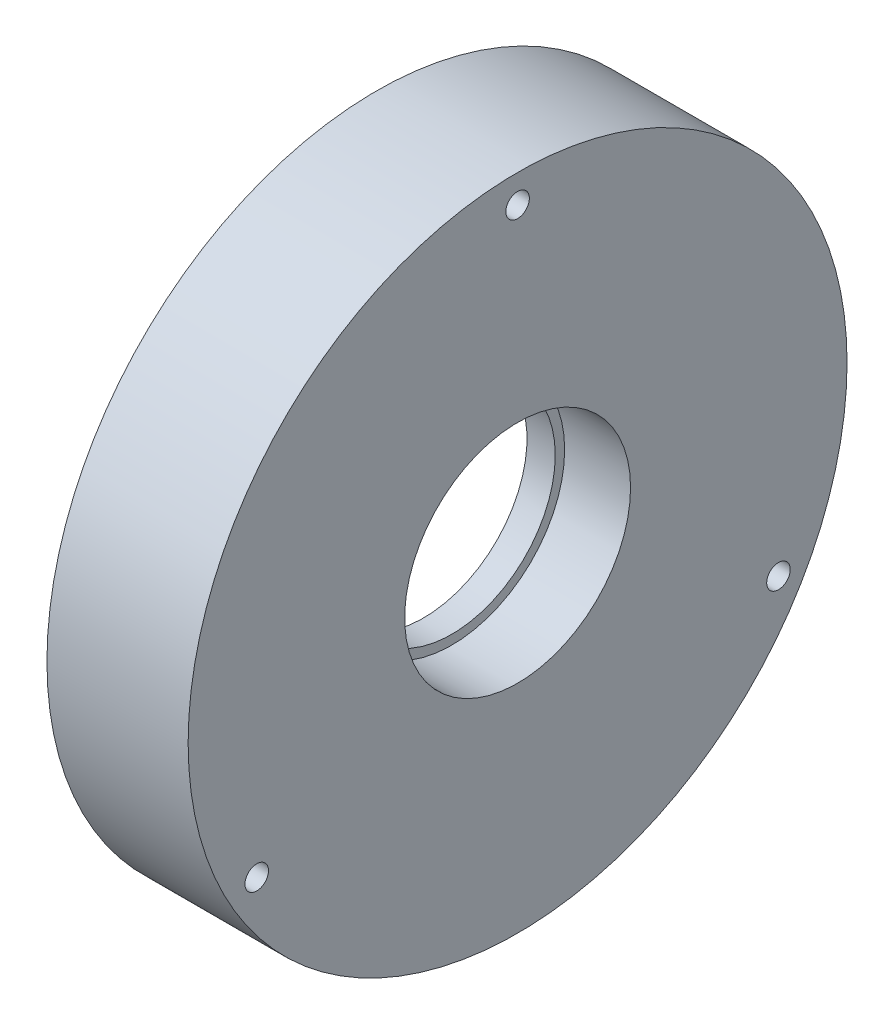
from build123d import *

# Parameters (mm, degrees)
BASPROSKE_W         = 5
BASPROSKE_H         = 4.25
TOOTHCUT_DEPTH      = 26.248762346
TEETHCUTS_COUNT     = 55
TEETHCUTS_ANGLE     = 353.454545455
BOSS_EXTRUDE1_START = 2.5
SKETCH1_R           = 17.5
SKETCH1_R_2         = 5.5
BOSS_EXTRUDE1_DEPTH = 2.5
SKETCH2_R           = 7.75
SKETCH2_R_2         = 5.5
BOSS_EXTRUDE2_DEPTH = 2.5
SKETCH3_R           = 6
CUT_EXTRUDE1_DEPTH  = 3.5
M1_6_TAPPED_HOLE1_D = 1.25
CIRPATTERN1_COUNT   = 3


with BuildPart() as part:
    # BasProSke → Base-Revolve (revolve)
    with BuildSketch(Plane(origin=(0, 0, 0), x_dir=(1, 0, 0), z_dir=(0, 1, 0)), mode=Mode.PRIVATE) as base_revolve_sk:
        with Locations((2.5, 15.375)):
            Rectangle(BASPROSKE_W, BASPROSKE_H)
    revolve(base_revolve_sk.sketch.rotate(Axis((-10, 0, 0), (1, 0, 0)), 180), axis=Axis((-10, 0, 0), (1, 0, 0)))

    # TooCutSke → ToothCut (cut, through all)
    with BuildSketch(Plane(origin=(0, 0, 0), x_dir=(0, 0, -1), z_dir=(1, 0, 0))):
        with BuildLine():
            ThreePointArc((0.61765291, 13.210168434), (0.417066145, 13.802967889), (0.163405078, 14.375071297))
            ThreePointArc((0.163405078, 14.375071297), (0, 14.376), (-0.163405078, 14.375071297))
            ThreePointArc((-0.163405078, 14.375071297), (-0.417066145, 13.802967889), (-0.61765291, 13.210168434))
            ThreePointArc((-0.61765291, 13.210168434), (0, 13.2246), (0.61765291, 13.210168434))
        make_face()
    toothcut = extrude(amount=TOOTHCUT_DEPTH, mode=Mode.SUBTRACT)

    # TeethCuts: ToothCut ×55 about axis
    teethcuts_axis = Axis((-10, 0, 0), (1, 0, 0))
    for i in range(1, TEETHCUTS_COUNT):
        add(toothcut.rotate(teethcuts_axis, i * TEETHCUTS_ANGLE / (TEETHCUTS_COUNT - 1)), mode=Mode.SUBTRACT)

    # Sketch1 → Boss-Extrude1 (add)
    with BuildSketch(Plane(origin=(5, 0, 0), x_dir=(0, 0, -1), z_dir=(1, 0, 0)).offset(BOSS_EXTRUDE1_START)):
        with Locations(Location((0, 0, 0), (0, 0, 180))):
            Circle(SKETCH1_R)
        Circle(SKETCH1_R_2, mode=Mode.SUBTRACT)
    extrude(amount=-BOSS_EXTRUDE1_DEPTH)

    # Sketch2 → Boss-Extrude2 (add)
    with BuildSketch(Plane.ZY.offset(-5)):
        with Locations(Location((0, 0, 0), (0, 0, 180))):
            Circle(SKETCH2_R)
        Circle(SKETCH2_R_2, mode=Mode.SUBTRACT)
    extrude(amount=BOSS_EXTRUDE2_DEPTH)

    # Sketch3 → Cut-Extrude1 (cut)
    with BuildSketch(Plane(origin=(7.5, 0, 0), x_dir=(0, 0, -1), z_dir=(1, 0, 0))):
        Circle(SKETCH3_R)
    extrude(amount=-CUT_EXTRUDE1_DEPTH, mode=Mode.SUBTRACT)

    # M1.6 Tapped Hole1 (through all)
    with Locations(Plane(origin=(7.5, 0, 0), x_dir=(0, 0, -1), z_dir=(1, 0, 0))):
        with Locations((0, 16)):
            m1_6_tapped_hole1 = Hole(M1_6_TAPPED_HOLE1_D / 2)

    # CirPattern1: M1.6 Tapped Hole1 ×3 about axis
    cirpattern1_axis = Axis((0, 0, 0), (1, 0, 0))
    for i in range(1, CIRPATTERN1_COUNT):
        add(m1_6_tapped_hole1.rotate(cirpattern1_axis, i * 360 / CIRPATTERN1_COUNT), mode=Mode.SUBTRACT)


solid = part.part
